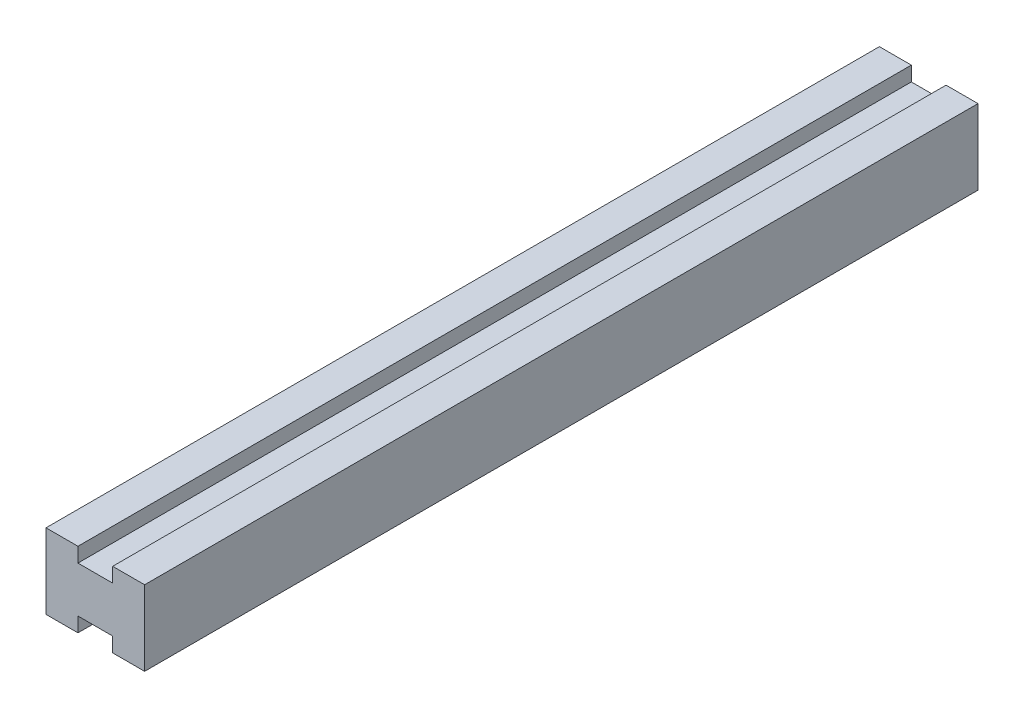
from build123d import *

# Parameters (mm, degrees)
BOSS_EXTRUDE1_DEPTH = 60


with BuildPart() as part:
    # Sketch1 → Boss-Extrude1 (new body)
    with BuildSketch(Plane.XY):
        Polygon((-1.3, 2.75), (-3.6, 2.75), (-3.6, -2.65), (-1.3, -2.65), (-1.3, -1.6), (1.2, -1.6), (1.2, -2.65), (3.5, -2.65), (3.5, 2.75), (1.2, 2.75), (1.2, 1.7), (-1.3, 1.7), align=None)
    extrude(amount=BOSS_EXTRUDE1_DEPTH)


solid = part.part
